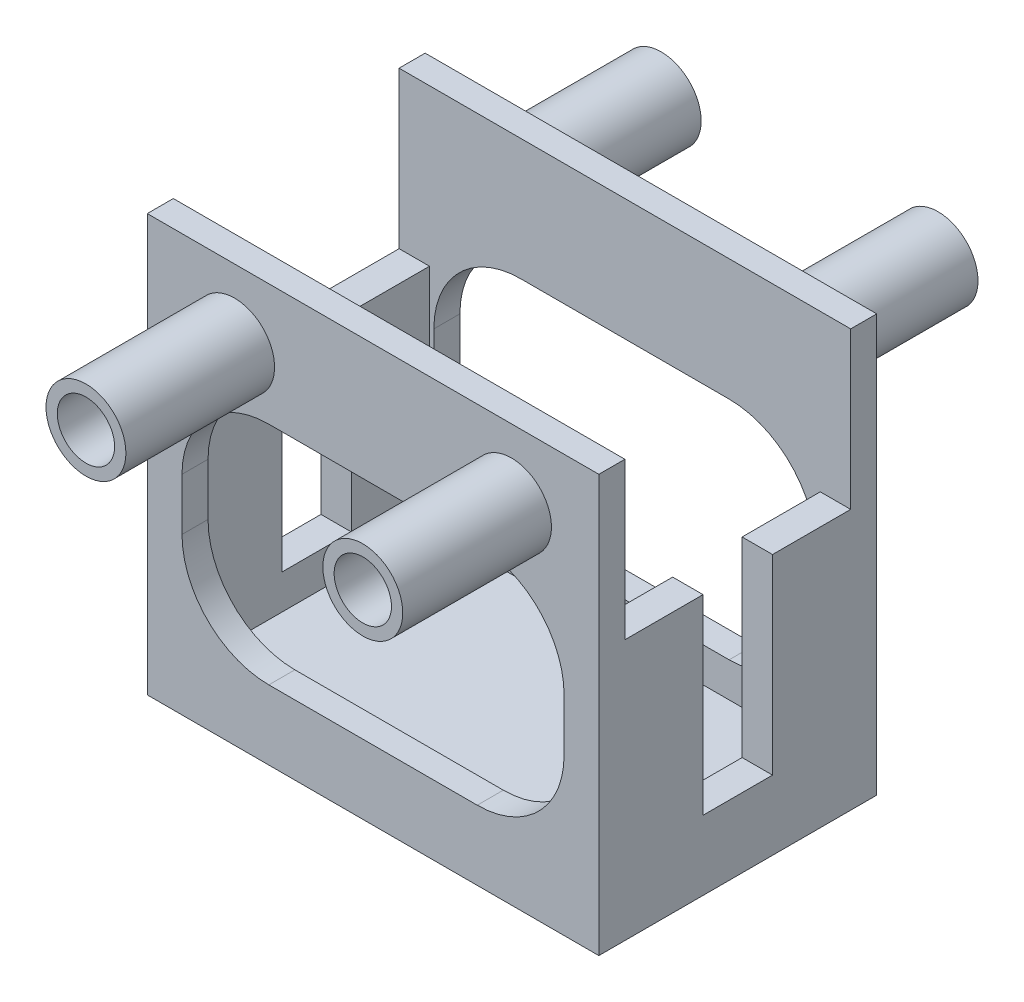
from build123d import *

# Parameters (mm, degrees)
SKETCH2_W           = 26
SKETCH2_H           = 16
BOSS_EXTRUDE1_DEPTH = 2
SKETCH3_W           = 26
SKETCH3_H           = 16
SKETCH3_W_2         = 22.5
SKETCH3_H_2         = 13
BOSS_EXTRUDE2_DEPTH = 22
CUT_EXTRUDE1_REACH  = 40.833
CUT_EXTRUDE2_REACH  = 40.833
CUT_EXTRUDE3_REACH  = 40.833
CUT_EXTRUDE4_REACH  = 40.833
SKETCH10_R          = 2.3
BOSS_EXTRUDE3_DEPTH = 8.56
BOSS_EXTRUDE4_START = 8.56
SKETCH11_R          = 2.3
BOSS_EXTRUDE4_DEPTH = 8.56
SKETCH12_R          = 1.65
CUT_EXTRUDE5_DEPTH  = 8.56
CUT_EXTRUDE6_START  = -8.56
SKETCH13_R          = 1.65
CUT_EXTRUDE6_DEPTH  = 8.56


with BuildPart() as part:
    # Sketch2 → Boss-Extrude1 (new body)
    with BuildSketch(Plane(origin=(0, 0, 0), x_dir=(1, 0, 0), z_dir=(0, 1, 0))):
        with Locations((13, 8)):
            Rectangle(SKETCH2_W, SKETCH2_H)
    extrude(amount=BOSS_EXTRUDE1_DEPTH)

    # Sketch3 → Boss-Extrude2 (add)
    with BuildSketch(Plane(origin=(0, 2, 0), x_dir=(1, 0, 0), z_dir=(0, 1, 0))):
        with Locations((13, 8)):
            Rectangle(SKETCH3_W, SKETCH3_H)
        with Locations((13, 8)):
            Rectangle(SKETCH3_W_2, SKETCH3_H_2, mode=Mode.SUBTRACT)
    extrude(amount=BOSS_EXTRUDE2_DEPTH)

    # Sketch6 → Cut-Extrude1 (cut, up to next)
    with BuildSketch(Plane.ZY, mode=Mode.PRIVATE) as cut_extrude1_sk1:
        Polygon((-14.5, 24), (-14.5, 15), (-10, 15), (-10, 4), (-6, 4), (-6, 15), (-1.5, 15), (-1.5, 24), align=None)
    cut_extrude1_tool1 = extrude(cut_extrude1_sk1.sketch, amount=-CUT_EXTRUDE1_REACH, mode=Mode.PRIVATE) & part.part
    add(cut_extrude1_tool1.solids().sort_by_distance((0, 16.767081, -8))[0], mode=Mode.SUBTRACT)

    # Sketch7 → Cut-Extrude2 (cut, up to next)
    with BuildSketch(Plane(origin=(26, 0, 0), x_dir=(0, 0, -1), z_dir=(1, 0, 0)), mode=Mode.PRIVATE) as cut_extrude2_sk1:
        Polygon((1.5, 24), (1.5, 15), (6, 15), (6, 4), (10, 4), (10, 15), (14.5, 15), (14.5, 24), align=None)
    cut_extrude2_tool1 = extrude(cut_extrude2_sk1.sketch, amount=-CUT_EXTRUDE2_REACH, mode=Mode.PRIVATE) & part.part
    add(cut_extrude2_tool1.solids().sort_by_distance((26, 16.767081, -8))[0], mode=Mode.SUBTRACT)

    # Sketch8 → Cut-Extrude3 (cut, up to next)
    with BuildSketch(Plane(origin=(0, 0, -16), x_dir=(-1, 0, 0), z_dir=(0, 0, -1)), mode=Mode.PRIVATE) as cut_extrude3_sk1:
        with BuildLine():
            Line((-24, 12), (-24, 9))
            ThreePointArc((-24, 9), (-22.535533906, 5.464466094), (-19, 4))
            Line((-19, 4), (-7, 4))
            ThreePointArc((-7, 4), (-3.464466094, 5.464466094), (-2, 9))
            Line((-2, 9), (-2, 12))
            ThreePointArc((-2, 12), (-3.464466094, 15.535533906), (-7, 17))
            Line((-7, 17), (-19, 17))
            ThreePointArc((-19, 17), (-22.535533906, 15.535533906), (-24, 12))
        make_face()
    cut_extrude3_tool1 = extrude(cut_extrude3_sk1.sketch, amount=-CUT_EXTRUDE3_REACH, mode=Mode.PRIVATE) & part.part
    add(cut_extrude3_tool1.solids().sort_by_distance((13, 10.5, -16))[0], mode=Mode.SUBTRACT)

    # Sketch9 → Cut-Extrude4 (cut, up to next)
    with BuildSketch(Plane.XY, mode=Mode.PRIVATE) as cut_extrude4_sk1:
        with BuildLine():
            Line((2, 12), (2, 9))
            ThreePointArc((2, 9), (3.464466094, 5.464466094), (7, 4))
            Line((7, 4), (19, 4))
            ThreePointArc((19, 4), (22.535533906, 5.464466094), (24, 9))
            Line((24, 9), (24, 12))
            ThreePointArc((24, 12), (22.535533906, 15.535533906), (19, 17))
            Line((19, 17), (7, 17))
            ThreePointArc((7, 17), (3.464466094, 15.535533906), (2, 12))
        make_face()
    cut_extrude4_tool1 = extrude(cut_extrude4_sk1.sketch, amount=-CUT_EXTRUDE4_REACH, mode=Mode.PRIVATE) & part.part
    add(cut_extrude4_tool1.solids().sort_by_distance((13, 10.5, 0))[0], mode=Mode.SUBTRACT)

    # Sketch10 → Boss-Extrude3 (add)
    with BuildSketch(Plane(origin=(0, 0, -16), x_dir=(-1, 0, 0), z_dir=(0, 0, -1))):
        with Locations(Location((-20.97, 20, 0), (0, 0, 180))):
            Circle(SKETCH10_R)
        with Locations(Location((-5.03, 20, 0), (0, 0, 180))):
            Circle(SKETCH10_R)
    extrude(amount=BOSS_EXTRUDE3_DEPTH)

    # Sketch11 → Boss-Extrude4 (add)
    with BuildSketch(Plane.XY.offset(BOSS_EXTRUDE4_START)):
        with Locations((5.03, 20)):
            Circle(SKETCH11_R)
        with Locations((20.97, 20)):
            Circle(SKETCH11_R)
    extrude(amount=-BOSS_EXTRUDE4_DEPTH)

    # Sketch12 → Cut-Extrude5 (cut)
    with BuildSketch(Plane(origin=(0, 0, -24.56), x_dir=(-1, 0, 0), z_dir=(0, 0, -1))):
        with Locations((-20.97, 20)):
            Circle(SKETCH12_R)
        with Locations((-5.03, 20)):
            Circle(SKETCH12_R)
    extrude(amount=-CUT_EXTRUDE5_DEPTH, mode=Mode.SUBTRACT)

    # Sketch13 → Cut-Extrude6 (cut)
    with BuildSketch(Plane.XY.offset(8.56).offset(CUT_EXTRUDE6_START)):
        with Locations(Location((5.03, 20, 0), (0, 0, 180))):
            Circle(SKETCH13_R)
        with Locations(Location((20.97, 20, 0), (0, 0, 180))):
            Circle(SKETCH13_R)
    extrude(amount=CUT_EXTRUDE6_DEPTH, mode=Mode.SUBTRACT)


solid = part.part
